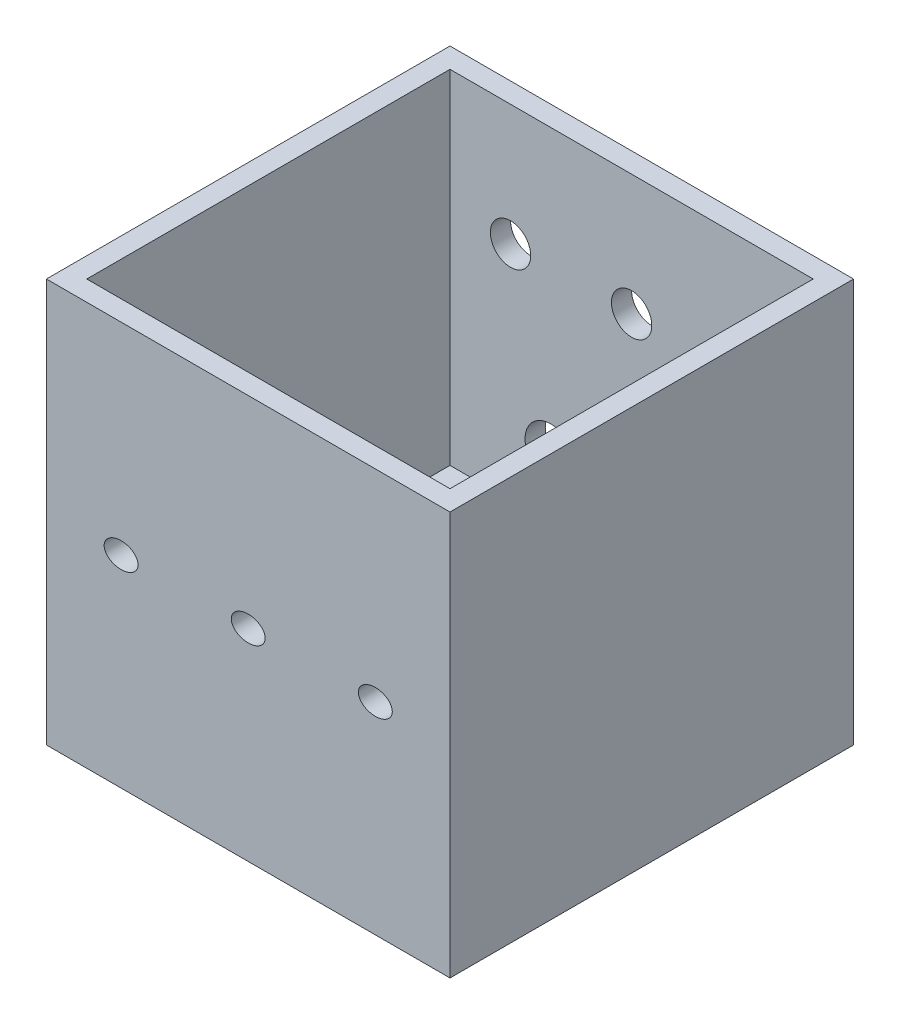
from build123d import *

# Parameters (mm, degrees)
SKETCH1_W           = 63.5
SKETCH1_H           = 63.5
BOSS_EXTRUDE1_DEPTH = 63.5
SKETCH2_RX          = 2.667
SKETCH2_RY          = 1.9685
CUT_EXTRUDE1_DEPTH  = 3.175
SKETCH3_W           = 57.15
SKETCH3_H           = 57.15
CUT_EXTRUDE2_DEPTH  = 53.975
CUT_EXTRUDE3_REACH  = 79.771
SKETCH4_R           = 4.064
CUT_EXTRUDE4_REACH  = 79.771
SKETCH5_R           = 3.175


with BuildPart() as part:
    # Sketch1 → Boss-Extrude1 (new body)
    with BuildSketch(Plane.XY):
        Rectangle(SKETCH1_W, SKETCH1_H)
    extrude(amount=BOSS_EXTRUDE1_DEPTH)

    # Sketch2 → Cut-Extrude1 (cut)
    with BuildSketch(Plane.XY.offset(63.5)):
        with Locations((0, 0)):
            Ellipse(SKETCH2_RX, SKETCH2_RY)
        with Locations((20, 0)):
            Ellipse(SKETCH2_RX, SKETCH2_RY)
        with Locations((-20, 0)):
            Ellipse(SKETCH2_RX, SKETCH2_RY)
    extrude(amount=-CUT_EXTRUDE1_DEPTH, mode=Mode.SUBTRACT)

    # Sketch3 → Cut-Extrude2 (cut)
    with BuildSketch(Plane(origin=(0, 31.75, 0), x_dir=(1, 0, 0), z_dir=(0, 1, 0))):
        with Locations((0, -31.75)):
            Rectangle(SKETCH3_W, SKETCH3_H)
    extrude(amount=-CUT_EXTRUDE2_DEPTH, mode=Mode.SUBTRACT)

    # Sketch4 → Cut-Extrude3 (cut, up to next)
    with BuildSketch(Plane(origin=(0, 0, 0), x_dir=(-1, 0, 0), z_dir=(0, 0, -1)), mode=Mode.PRIVATE) as cut_extrude3_sk1:
        with Locations((-12.5984, -12.7)):
            Circle(SKETCH4_R)
    cut_extrude3_tool1 = extrude(cut_extrude3_sk1.sketch, amount=-CUT_EXTRUDE3_REACH, mode=Mode.PRIVATE) & part.part
    # Sketch4 → Cut-Extrude3 (cut, up to next)
    with BuildSketch(Plane(origin=(0, 0, 0), x_dir=(-1, 0, 0), z_dir=(0, 0, -1)), mode=Mode.PRIVATE) as cut_extrude3_sk2:
        with Locations((12.7, -12.7)):
            Circle(SKETCH4_R)
    cut_extrude3_tool2 = extrude(cut_extrude3_sk2.sketch, amount=-CUT_EXTRUDE3_REACH, mode=Mode.PRIVATE) & part.part
    add(cut_extrude3_tool1.solids().sort_by_distance((12.5984, -12.7, 0))[0], mode=Mode.SUBTRACT)
    add(cut_extrude3_tool2.solids().sort_by_distance((-12.7, -12.7, 0))[0], mode=Mode.SUBTRACT)

    # Sketch5 → Cut-Extrude4 (cut, up to next)
    with BuildSketch(Plane(origin=(0, 0, 0), x_dir=(-1, 0, 0), z_dir=(0, 0, -1)), mode=Mode.PRIVATE) as cut_extrude4_sk1:
        with Locations((-19.05, 12.7)):
            Circle(SKETCH5_R)
    cut_extrude4_tool1 = extrude(cut_extrude4_sk1.sketch, amount=-CUT_EXTRUDE4_REACH, mode=Mode.PRIVATE) & part.part
    # Sketch5 → Cut-Extrude4 (cut, up to next)
    with BuildSketch(Plane(origin=(0, 0, 0), x_dir=(-1, 0, 0), z_dir=(0, 0, -1)), mode=Mode.PRIVATE) as cut_extrude4_sk2:
        with Locations((0, 12.7)):
            Circle(SKETCH5_R)
    cut_extrude4_tool2 = extrude(cut_extrude4_sk2.sketch, amount=-CUT_EXTRUDE4_REACH, mode=Mode.PRIVATE) & part.part
    # Sketch5 → Cut-Extrude4 (cut, up to next)
    with BuildSketch(Plane(origin=(0, 0, 0), x_dir=(-1, 0, 0), z_dir=(0, 0, -1)), mode=Mode.PRIVATE) as cut_extrude4_sk3:
        with Locations((19.05, 12.7)):
            Circle(SKETCH5_R)
    cut_extrude4_tool3 = extrude(cut_extrude4_sk3.sketch, amount=-CUT_EXTRUDE4_REACH, mode=Mode.PRIVATE) & part.part
    add(cut_extrude4_tool1.solids().sort_by_distance((19.05, 12.7, 0))[0], mode=Mode.SUBTRACT)
    add(cut_extrude4_tool2.solids().sort_by_distance((0, 12.7, 0))[0], mode=Mode.SUBTRACT)
    add(cut_extrude4_tool3.solids().sort_by_distance((-19.05, 12.7, 0))[0], mode=Mode.SUBTRACT)


solid = part.part
